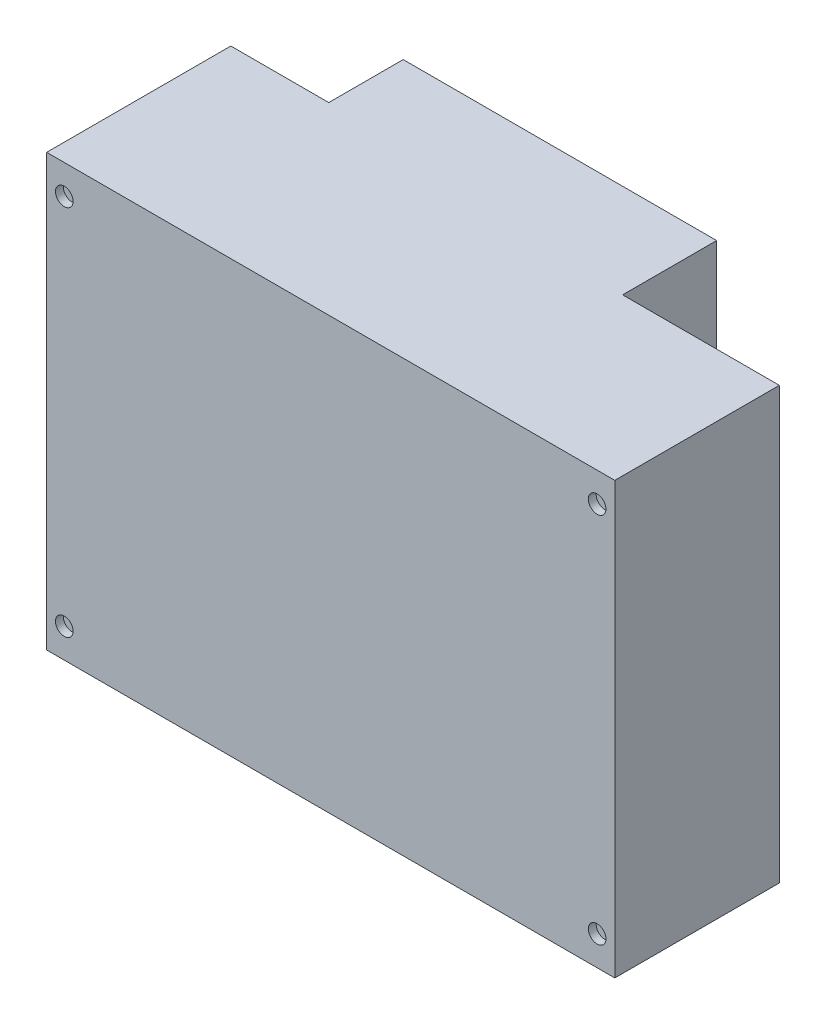
from build123d import *

# Parameters (mm, degrees)
SKETCH1_W                = 145
SKETCH1_H                = 110
SKETCH1_R                = 2.25
BOSS_EXTRUDE1_DEPTH      = 2
BOSS_EXTRUDE2_DEPTH      = 55
BOSS_EXTRUDE2_DEPTH_BACK = 55


with BuildPart() as part:
    # Sketch1 → Boss-Extrude1 (new body)
    with BuildSketch(Plane.XY):
        Rectangle(SKETCH1_W, SKETCH1_H)
        with Locations((-68, -47.5)):
            Circle(SKETCH1_R, mode=Mode.SUBTRACT)
        with Locations(Location((68, -47.5, 0), (0, 0, 180))):
            Circle(SKETCH1_R, mode=Mode.SUBTRACT)
        with Locations((68, 47.5)):
            Circle(SKETCH1_R, mode=Mode.SUBTRACT)
        with Locations(Location((-68, 47.5, 0), (0, 0, 180))):
            Circle(SKETCH1_R, mode=Mode.SUBTRACT)
    extrude(amount=BOSS_EXTRUDE1_DEPTH)

    # Sketch3 → Boss-Extrude2 (add, two sides: drawn at the far end of the back side and taken through both)
    with BuildSketch(Plane(origin=(0, 0, 0), x_dir=(1, 0, 0), z_dir=(0, 1, 0)).offset(-BOSS_EXTRUDE2_DEPTH_BACK)):
        Polygon((-72.5, 0), (-72.5, 45), (-47.5, 45), (-47.5, 64), (32.5, 64), (32.5, 40), (72.5, 40), (72.5, 0), align=None)
    extrude(amount=BOSS_EXTRUDE2_DEPTH + BOSS_EXTRUDE2_DEPTH_BACK)


solid = part.part
